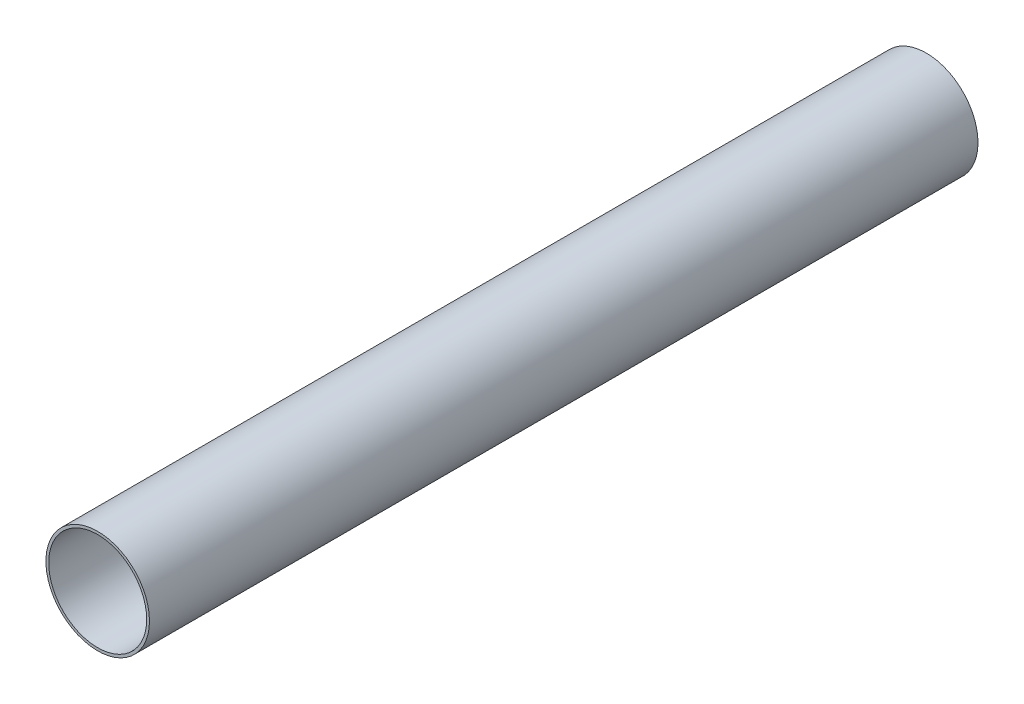
from build123d import *

# Parameters (mm, degrees)
SKETCH1_R           = 37.5
SKETCH1_R_2         = 35.5
BOSS_EXTRUDE1_DEPTH = 600


with BuildPart() as part:
    # Sketch1 → Boss-Extrude1 (new body)
    with BuildSketch(Plane.XY):
        Circle(SKETCH1_R)
        Circle(SKETCH1_R_2, mode=Mode.SUBTRACT)
    extrude(amount=BOSS_EXTRUDE1_DEPTH)


solid = part.part
